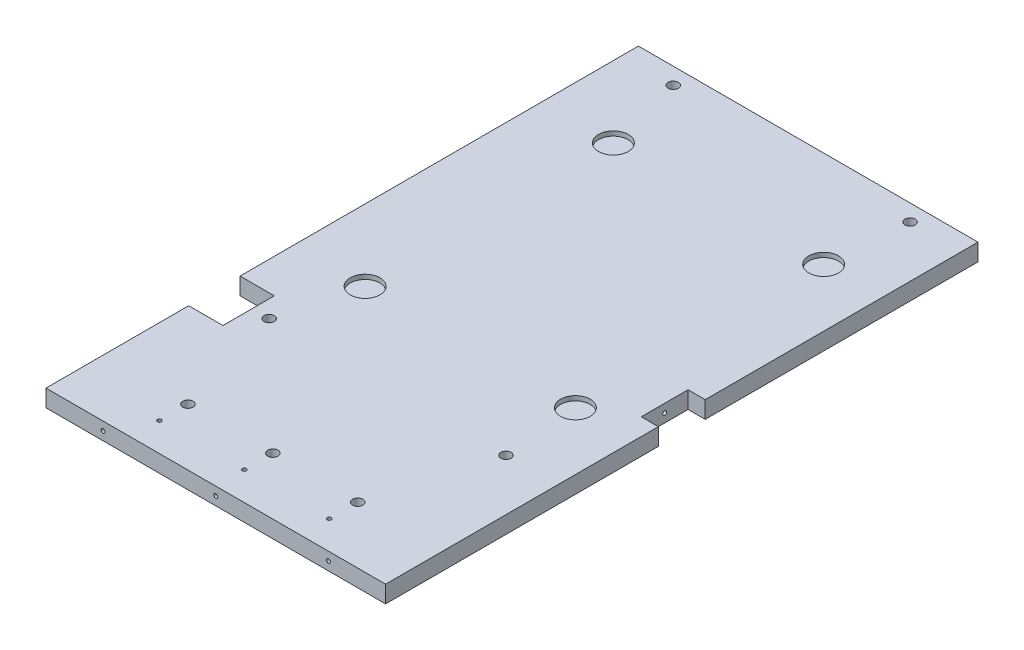
from build123d import *

# Parameters (mm, degrees)
SKETCH_1_W          = 59.5
SKETCH_1_H          = 103.8
EXTRUDE_1_DEPTH     = 3
SKETCH_2_R          = 2.6
CUT_EXTRUDE_1_DEPTH = 0.8
SKETCH_3_W          = 8.2
SKETCH_3_H          = 3
CUT_EXTRUDE_2_DEPTH = 3
CUT_EXTRUDE_START   = -3
SKETCH_3_3_R        = 0.35
CUT_EXTRUDE_4_DEPTH = 3
SKETCH_4_R          = 0.35
CUT_EXTRUDE_5_DEPTH = 3
SKETCH_5_R          = 0.35
CUT_EXTRUDE_6_DEPTH = 3
SKETCH_8_W          = 6
SKETCH_8_H          = 9
CUT_EXTRUDE_7_DEPTH = 60.897182738
SKETCH_9_R          = 0.9
CUT_EXTRUDE_8_DEPTH = 60.897182738
SKETCH_10_R         = 0.35
SKETCH_10_R_2       = 0.9
CUT_EXTRUDE_9_DEPTH = 60.89718283


with BuildPart() as part:
    # 草图1 → 凸台-拉伸1 (new body)
    with BuildSketch(Plane(origin=(0, 0, 0), x_dir=(1, 0, 0), z_dir=(0, 1, 0))):
        Rectangle(SKETCH_1_W, SKETCH_1_H)
    extrude(amount=EXTRUDE_1_DEPTH)

    # 草图2 → 切除-拉伸1 (cut)
    with BuildSketch(Plane(origin=(0, 3, 0), x_dir=(1, 0, 0), z_dir=(0, 1, 0))):
        with Locations(Location((19.612933951, 35, 0), (0, 0, 270))):
            Circle(SKETCH_2_R)
        with Locations(Location((19.612933951, -8.5, 0), (0, 0, 270))):
            Circle(SKETCH_2_R)
        with Locations(Location((-17.24, -8.5, 0), (0, 0, 270))):
            Circle(SKETCH_2_R)
        with Locations(Location((-17.24, 35, 0), (0, 0, 270))):
            Circle(SKETCH_2_R)
    extrude(amount=-CUT_EXTRUDE_1_DEPTH, mode=Mode.SUBTRACT)

    # 草图3 → 切除-拉伸2 (cut)
    with BuildSketch(Plane(origin=(29.75, 0, 0), x_dir=(0, 0, -1), z_dir=(1, 0, 0))):
        with Locations((0, 1.5)):
            Rectangle(SKETCH_3_W, SKETCH_3_H)
    extrude(amount=-CUT_EXTRUDE_2_DEPTH, mode=Mode.SUBTRACT)

    # 草图3<3> → 切除-拉伸4 (cut)
    with BuildSketch(Plane(origin=(29.75, 0, 0), x_dir=(0, 0, -1), z_dir=(1, 0, 0)).offset(CUT_EXTRUDE_START)):
        with Locations((0, 1.5)):
            Circle(SKETCH_3_3_R)
    extrude(amount=-CUT_EXTRUDE_4_DEPTH, mode=Mode.SUBTRACT)

    # 草图4 → 切除-拉伸5 (cut)
    with BuildSketch(Plane(origin=(0, 0, -51.9), x_dir=(-1, 0, 0), z_dir=(0, 0, -1))):
        with Locations((-19.75, 1.5)):
            Circle(SKETCH_4_R)
        with Locations((0, 1.5)):
            Circle(SKETCH_4_R)
        with Locations((19.75, 1.5)):
            Circle(SKETCH_4_R)
    cut_extrude_5 = extrude(amount=-CUT_EXTRUDE_5_DEPTH, mode=Mode.SUBTRACT)

    # 草图5 → 切除-拉伸6 (cut)
    with BuildSketch(Plane.ZY.offset(29.75)):
        with Locations((-34.6, 1.5)):
            Circle(SKETCH_5_R)
        with Locations((-17.3, 1.5)):
            Circle(SKETCH_5_R)
    cut_extrude_6 = extrude(amount=-CUT_EXTRUDE_6_DEPTH, mode=Mode.SUBTRACT)

    # 镜向1: 切除-拉伸5, 切除-拉伸6 across plane
    add(cut_extrude_5.mirror(Plane.XY), mode=Mode.SUBTRACT)
    add(cut_extrude_6.mirror(Plane.XY), mode=Mode.SUBTRACT)

    # 草图8 → 切除-拉伸7 (cut, through all)
    with BuildSketch(Plane(origin=(0, 3, 0), x_dir=(1, 0, 0), z_dir=(0, 1, 0))):
        with Locations((-26.75, -22.4)):
            Rectangle(SKETCH_8_W, SKETCH_8_H)
    extrude(amount=-CUT_EXTRUDE_7_DEPTH, mode=Mode.SUBTRACT)

    # 草图9 → 切除-拉伸8 (cut, through all)
    with BuildSketch(Plane(origin=(0, 3, 0), x_dir=(1, 0, 0), z_dir=(0, 1, 0))):
        with Locations(Location((-20.75, 49, 0), (0, 0, 270))):
            Circle(SKETCH_9_R)
        with Locations(Location((20.75, 49, 0), (0, 0, 270))):
            Circle(SKETCH_9_R)
        with Locations(Location((-20.75, -21.8, 0), (0, 0, 270))):
            Circle(SKETCH_9_R)
        with Locations(Location((20.75, -21.8, 0), (0, 0, 270))):
            Circle(SKETCH_9_R)
    extrude(amount=-CUT_EXTRUDE_8_DEPTH, mode=Mode.SUBTRACT)

    # 草图10 → 切除-拉伸9 (cut, through all)
    with BuildSketch(Plane(origin=(0, 3, 0), x_dir=(1, 0, 0), z_dir=(0, 1, 0))):
        with Locations(Location((14.875, -46.9, 0), (0, 0, 270))):
            Circle(SKETCH_10_R)
        with Locations(Location((-14.875, -46.9, 0), (0, 0, 270))):
            Circle(SKETCH_10_R)
        with Locations(Location((14.875, -41.9, 0), (0, 0, 270))):
            Circle(SKETCH_10_R_2)
        with Locations(Location((-14.875, -41.9, 0), (0, 0, 270))):
            Circle(SKETCH_10_R_2)
        with Locations(Location((0, -46.9, 0), (0, 0, 270))):
            Circle(SKETCH_10_R)
        with Locations(Location((0, -41.9, 0), (0, 0, 270))):
            Circle(SKETCH_10_R_2)
    extrude(amount=-CUT_EXTRUDE_9_DEPTH, mode=Mode.SUBTRACT)


solid = part.part
